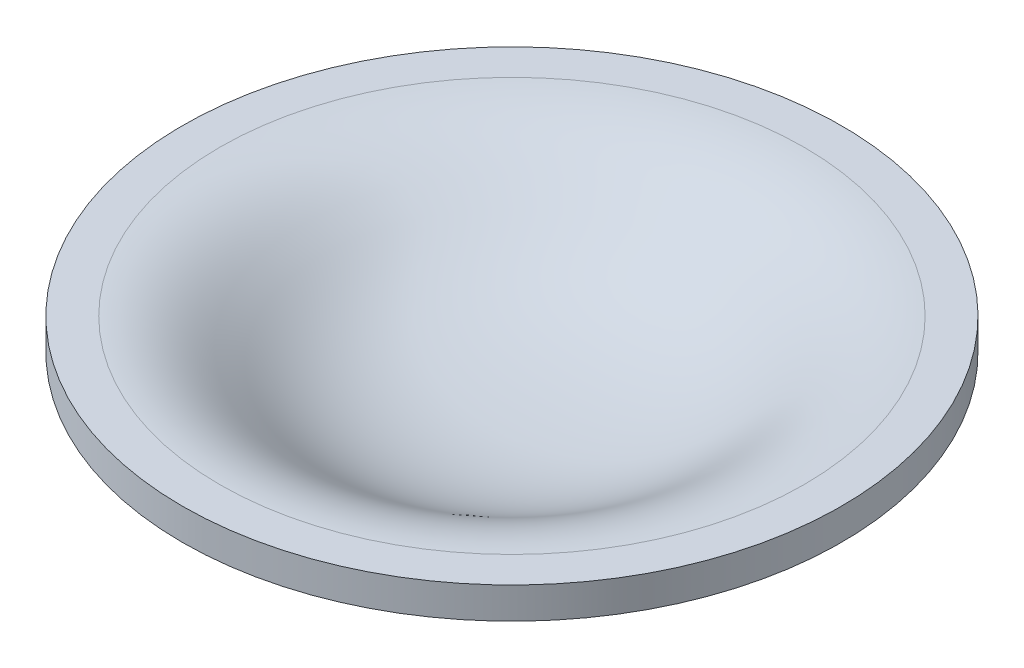
from build123d import *


with BuildPart() as part:
    # Esquisse1 → Révolution1 (revolve)
    with BuildSketch(Plane.XY, mode=Mode.PRIVATE) as r_volution1_sk:
        with BuildLine():
            Line((105, 30), (105, 40))
            Line((105, 40), (93.088412426, 40))
            add(Edge.make_bspline(
                [(0, 10), (0.930194341, 10), (2.812942981, 10.013925993), (6.398950661, 10.095393794), (10.675004764, 10.293832807), (15.453174691, 10.673913572), (21.390002578, 11.353205029), (28.034617451, 12.494451998), (34.918360171, 14.235387817), (40.875534638, 16.26193706), (47.813353179, 19.252490211), (55.047199045, 23.398071324), (62.769613372, 28.758014608), (69.501570981, 33.279952626), (75.747561697, 36.464692845), (80.971155824, 38.415712992), (85.793632468, 39.485941654), (89.876719226, 39.925411017), (92.026199619, 40), (93.088412426, 40)],
                knots=[0, 0, 0, 0, 0.015625, 0.03125, 0.0625, 0.09375, 0.125, 0.1875, 0.25, 0.3125, 0.375, 0.5, 0.625, 0.75, 0.8125, 0.875, 0.9375, 0.96875, 1, 1, 1, 1], degree=3))
            Line((0, 10), (0, 0))
            add(Edge.make_bspline(
                [(0, 0), (63.671005594, 0), (65.874750563, 30), (93.088412426, 30)],
                knots=[0, 0, 0, 0, 1, 1, 1, 1], degree=3))
            Line((93.088412426, 30), (105, 30))
        make_face()
    revolve(r_volution1_sk.sketch.rotate(Axis((0, 0, 0), (0, -1, 0)), 90), axis=Axis((0, 0, 0), (0, -1, 0)))


solid = part.part
